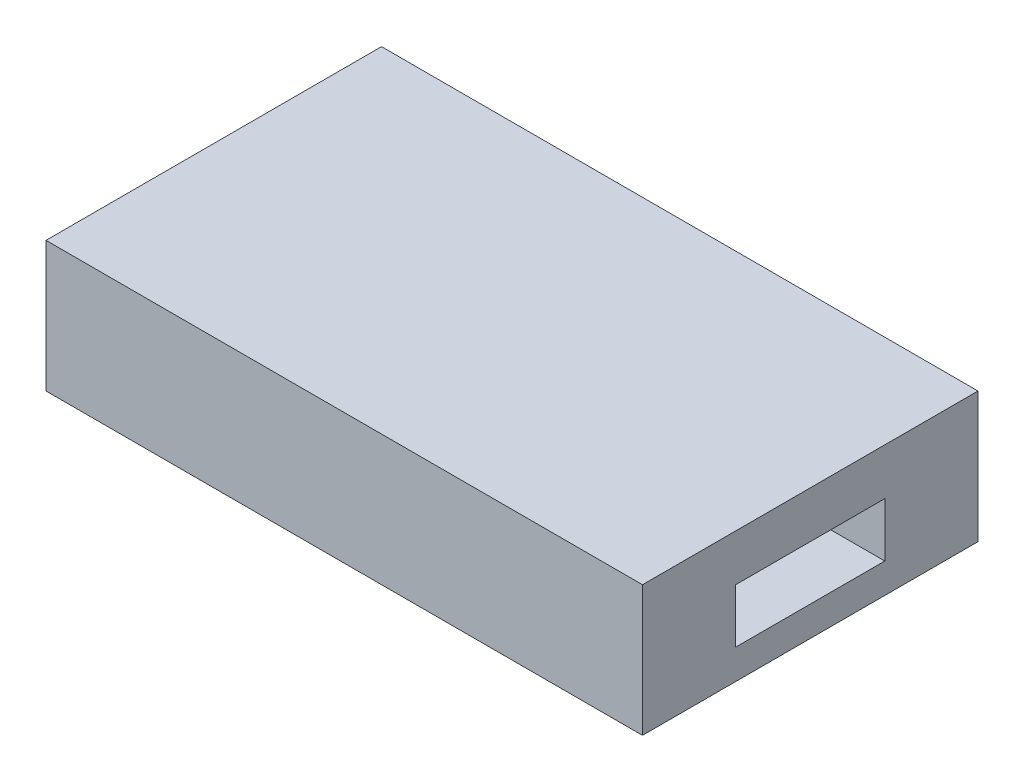
from build123d import *

# Parameters (mm, degrees)
SKETCH1_W           = 32
SKETCH1_H           = 18
BOSS_EXTRUDE1_DEPTH = 7
SKETCH2_W           = 8
SKETCH2_H           = 2.9
CUT_EXTRUDE1_DEPTH  = 5


with BuildPart() as part:
    # Sketch1 → Boss-Extrude1 (new body)
    with BuildSketch(Plane(origin=(0, 0, 0), x_dir=(1, 0, 0), z_dir=(0, 1, 0))):
        with Locations((16, 9)):
            Rectangle(SKETCH1_W, SKETCH1_H)
    extrude(amount=BOSS_EXTRUDE1_DEPTH)

    # Sketch2 → Cut-Extrude1 (cut)
    with BuildSketch(Plane(origin=(32, 0, 0), x_dir=(0, 0, -1), z_dir=(1, 0, 0))):
        with Locations((9, 3.05)):
            Rectangle(SKETCH2_W, SKETCH2_H)
    extrude(amount=-CUT_EXTRUDE1_DEPTH, mode=Mode.SUBTRACT)


solid = part.part
